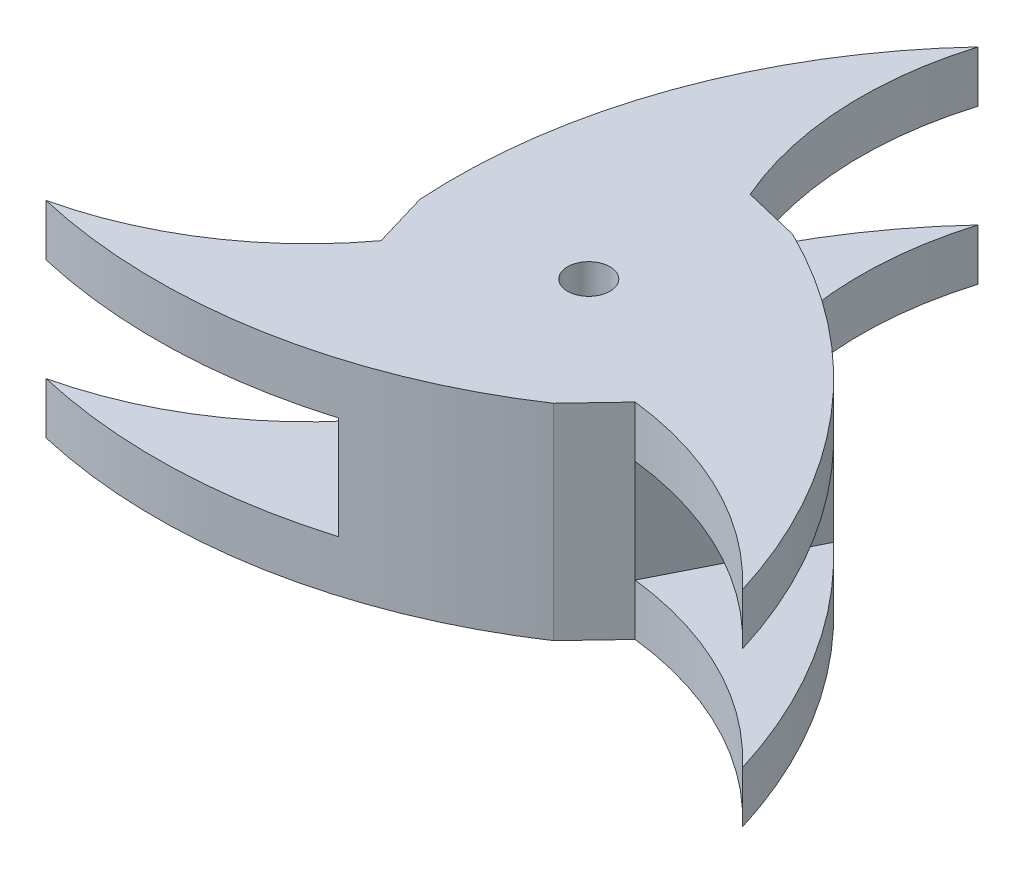
from build123d import *

# Parameters (mm, degrees)
BOSS_EXTRUDE2_DEPTH = 25.4
SKETCH6_W           = 29.894889523
SKETCH6_H           = 12.7
CUT_EXTRUDE2_DEPTH  = 25.4
SKETCH7_W           = 29.894889523
SKETCH7_H           = 12.7
CUT_EXTRUDE3_DEPTH  = 25.4
SKETCH8_W           = 29.894889523
SKETCH8_H           = 12.7
CUT_EXTRUDE4_DEPTH  = 25.4
SKETCH9_R           = 2.625984609
CUT_EXTRUDE5_DEPTH  = 25.4


with BuildPart() as part:
    # Sketch5 → Boss-Extrude2 (new body)
    with BuildSketch(Plane(origin=(0, 0, 0), x_dir=(1, 0, 0), z_dir=(0, 1, 0))):
        with BuildLine():
            Line((0.906871592, 19.028402033), (7.829859105, 17.366513939))
            ThreePointArc((7.829859105, 17.366513939), (29.524645576, 0.411973336), (42.722311342, -23.75291494))
            ThreePointArc((42.722311342, -23.75291494), (30.571840916, -14.649217341), (16.025643758, -10.299574853))
            Line((16.025643758, -10.299574853), (11.124912694, -15.464113863))
            ThreePointArc((11.124912694, -15.464113863), (-14.405543413, -25.775079775), (-41.931783423, -25.12214946))
            ThreePointArc((-41.931783423, -25.12214946), (-27.972514821, -19.151382203), (-16.93251535, -8.72882718))
            Line((-16.93251535, -8.72882718), (-18.954771799, -1.902400076))
            ThreePointArc((-18.954771799, -1.902400076), (-15.119102163, 25.363106438), (-0.790527919, 48.8750644))
            ThreePointArc((-0.790527919, 48.8750644), (-2.599326095, 33.800599544), (0.906871592, 19.028402033))
        make_face()
    extrude(amount=BOSS_EXTRUDE2_DEPTH)

    # Sketch6 → Cut-Extrude2 (cut)
    with BuildSketch(Plane(origin=(1.982617129, 0, -0.112752753), x_dir=(-0.05677891901057157, 0, -0.9983867759320488), z_dir=(0.9983867759320488, 0, -0.05677891901057157))):
        with Locations((33.89365853, 12.7)):
            Rectangle(SKETCH6_W, SKETCH6_H)
    extrude(amount=-CUT_EXTRUDE2_DEPTH, mode=Mode.SUBTRACT)

    # Sketch7 → Cut-Extrude3 (cut)
    with BuildSketch(Plane(origin=(-0.893661816, 0, 1.773373176), x_dir=(0.8930177702648826, 0, 0.45002140170344945), z_dir=(-0.4500214017034494, 0, 0.8930177702648825))):
        with Locations((33.89365853, 12.7)):
            Rectangle(SKETCH7_W, SKETCH7_H)
    extrude(amount=-CUT_EXTRUDE3_DEPTH, mode=Mode.SUBTRACT)

    # Sketch8 → Cut-Extrude4 (cut)
    with BuildSketch(Plane(origin=(-1.088955313, 0, -1.660620423), x_dir=(-0.8362388512543109, 0, 0.5483653742285982), z_dir=(-0.5483653742285982, 0, -0.8362388512543109))):
        with Locations((33.89365853, 12.7)):
            Rectangle(SKETCH8_W, SKETCH8_H)
    extrude(amount=-CUT_EXTRUDE4_DEPTH, mode=Mode.SUBTRACT)

    # Sketch9 → Cut-Extrude5 (cut)
    with BuildSketch(Plane(origin=(0, 0, 0), x_dir=(1, 0, 0), z_dir=(0, 1, 0))):
        with Locations(Location((0, 0, 0), (0, 0, 270))):
            Circle(SKETCH9_R)
    extrude(amount=CUT_EXTRUDE5_DEPTH, mode=Mode.SUBTRACT)


solid = part.part
